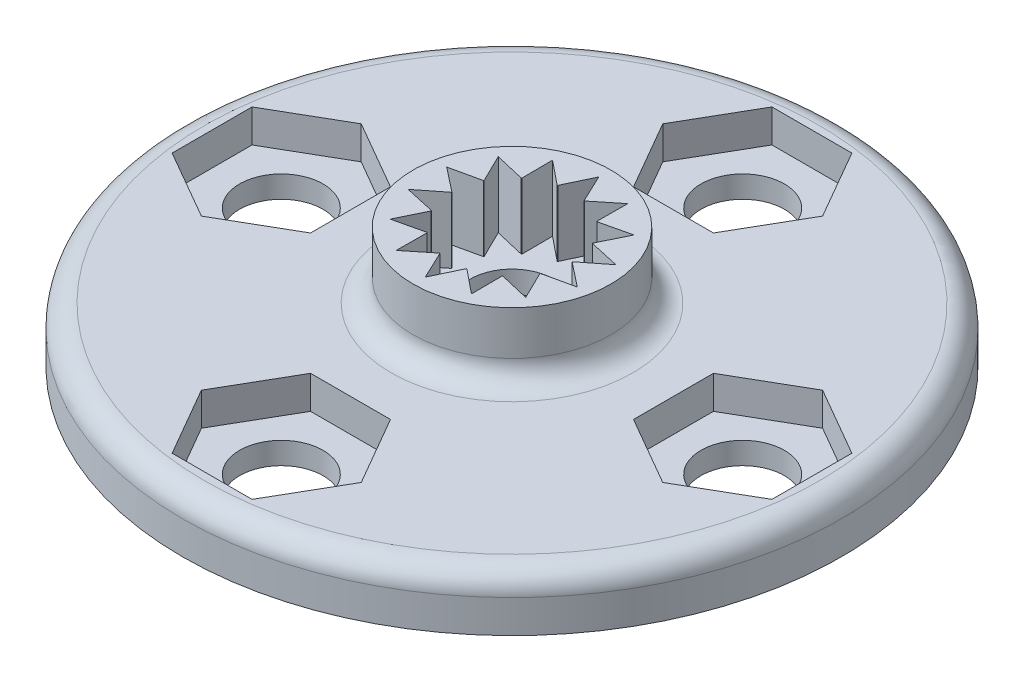
from build123d import *

# Parameters (mm, degrees)
CROQUIS1_R              = 15
SALIENTE_EXTRUIR1_DEPTH = 2.5
CROQUIS2_R              = 4.5
SALIENTE_EXTRUIR2_DEPTH = 3
CROQUIS3_R              = 2.75
CORTAR_EXTRUIR1_DEPTH   = 3
CORTAR_EXTRUIR2_REACH   = 23.915
CROQUIS4_R              = 1.9
CORTAR_EXTRUIR4_REACH   = 23.424
CROQUIS6_R              = 1.9
CORTAR_EXTRUIR3_START   = -1.5
CORTAR_EXTRUIR3_DEPTH   = 2.5
MATRIZC1_COUNT          = 4
CORTAR_EXTRUIR5_DEPTH   = 3
MATRIZC2_COUNT          = 14
REDONDEO1_R             = 1
CROQUIS9_R              = 3.2
CORTAR_EXTRUIR6_DEPTH   = 1.5


with BuildPart() as part:
    # Croquis1 → Saliente-Extruir1 (new body)
    with BuildSketch(Plane(origin=(0, 0, 0), x_dir=(1, 0, 0), z_dir=(0, 1, 0))):
        with Locations(Location((0, 0, 0), (0, 0, 270))):
            Circle(CROQUIS1_R)
    extrude(amount=SALIENTE_EXTRUIR1_DEPTH)

    # Croquis2 → Saliente-Extruir2 (add)
    with BuildSketch(Plane(origin=(0, 2.5, 0), x_dir=(1, 0, 0), z_dir=(0, 1, 0))):
        with Locations(Location((0, 0, 0), (0, 0, 270))):
            Circle(CROQUIS2_R)
    extrude(amount=SALIENTE_EXTRUIR2_DEPTH)

    # Croquis3 → Cortar-Extruir1 (cut)
    with BuildSketch(Plane(origin=(0, 5.5, 0), x_dir=(1, 0, 0), z_dir=(0, 1, 0))):
        with Locations(Location((0, 0, 0), (0, 0, 270))):
            Circle(CROQUIS3_R)
    extrude(amount=-CORTAR_EXTRUIR1_DEPTH, mode=Mode.SUBTRACT)

    # Croquis4 → Cortar-Extruir2 (cut, up to next)
    with BuildSketch(Plane.XZ, mode=Mode.PRIVATE) as cortar_extruir2_sk1:
        with Locations(Location((0, 0, 0), (0, 0, 270))):
            Circle(CROQUIS4_R)
    cortar_extruir2_tool1 = extrude(cortar_extruir2_sk1.sketch, amount=-CORTAR_EXTRUIR2_REACH, mode=Mode.PRIVATE) & part.part
    add(cortar_extruir2_tool1.solids().sort_by_distance((0, 0, 0))[0], mode=Mode.SUBTRACT)

    # Croquis6 → Cortar-Extruir4 (cut, up to next)
    with BuildSketch(Plane(origin=(0, 2.5, 0), x_dir=(1, 0, 0), z_dir=(0, 1, 0)), mode=Mode.PRIVATE) as cortar_extruir4_sk1:
        with Locations(Location((0, 10.5, 0), (0, 0, 270))):
            Circle(CROQUIS6_R)
    cortar_extruir4_tool1 = extrude(cortar_extruir4_sk1.sketch, amount=-CORTAR_EXTRUIR4_REACH, mode=Mode.PRIVATE) & part.part
    cortar_extruir4 = cortar_extruir4_tool1.solids().sort_by_distance((0, 2.5, -10.5))[0]
    add(cortar_extruir4, mode=Mode.SUBTRACT)

    # Croquis5 → Cortar-Extruir3 (cut)
    with BuildSketch(Plane(origin=(0, 2.5, 0), x_dir=(1, 0, 0), z_dir=(0, 1, 0)).offset(CORTAR_EXTRUIR3_START)):
        Polygon((-1.818653348, 13.65), (-3.637306696, 10.5), (-1.818653348, 7.35), (1.818653348, 7.35), (3.637306696, 10.5), (1.818653348, 13.65), align=None)
    cortar_extruir3 = extrude(amount=CORTAR_EXTRUIR3_DEPTH, mode=Mode.SUBTRACT)

    # MatrizC1: Cortar-Extruir4, Cortar-Extruir3 ×4 about axis
    matrizc1_axis = Axis((0, 0, 0), (0, 1, 0))
    add([cortar_extruir4.rotate(matrizc1_axis, i * 360 / MATRIZC1_COUNT) for i in range(1, MATRIZC1_COUNT)], mode=Mode.SUBTRACT)
    add([cortar_extruir3.rotate(matrizc1_axis, i * 360 / MATRIZC1_COUNT) for i in range(1, MATRIZC1_COUNT)], mode=Mode.SUBTRACT)

    # Croquis7 → Cortar-Extruir5 (cut)
    with BuildSketch(Plane(origin=(0, 5.5, 0), x_dir=(1, 0, 0), z_dir=(0, 1, 0))):
        with BuildLine():
            Line((0, 3.95), (0.6, 2.68374738))
            ThreePointArc((0.6, 2.68374738), (0, 2.75), (-0.6, 2.68374738))
            Line((-0.6, 2.68374738), (0, 3.95))
        make_face()
    cortar_extruir5 = extrude(amount=-CORTAR_EXTRUIR5_DEPTH, mode=Mode.SUBTRACT)

    # MatrizC2: Cortar-Extruir5 ×14 about axis
    matrizc2_axis = Axis((0, 0, 0), (0, 1, 0))
    for i in range(1, MATRIZC2_COUNT):
        add(cortar_extruir5.rotate(matrizc2_axis, i * 360 / MATRIZC2_COUNT), mode=Mode.SUBTRACT)

    # Redondeo1
    redondeo1_edges = [part.edges().sort_by_distance(p)[0] for p in [
        (0, 2.5, -15),
        (0, 2.5, -4.5),
    ]]
    fillet(redondeo1_edges, radius=REDONDEO1_R)

    # Croquis9 → Cortar-Extruir6 (cut)
    with BuildSketch(Plane.XZ):
        with Locations(Location((0, 0, 0), (0, 0, 270))):
            Circle(CROQUIS9_R)
    extrude(amount=-CORTAR_EXTRUIR6_DEPTH, mode=Mode.SUBTRACT)


solid = part.part
